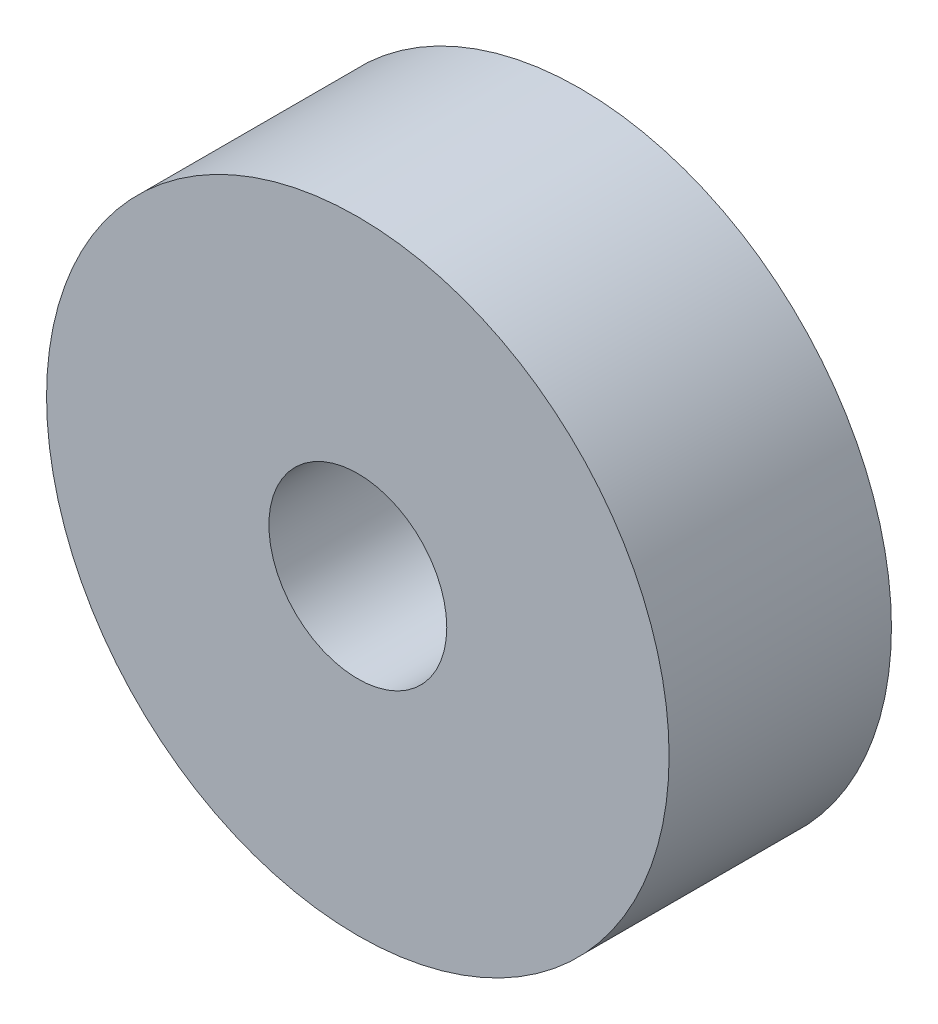
from build123d import *

# Parameters (mm, degrees)
SKETCH1_R           = 14
SKETCH1_R_2         = 4
BOSS_EXTRUDE1_DEPTH = 10


with BuildPart() as part:
    # Sketch1 → Boss-Extrude1 (new body)
    with BuildSketch(Plane.XY):
        Circle(SKETCH1_R)
        Circle(SKETCH1_R_2, mode=Mode.SUBTRACT)
    extrude(amount=BOSS_EXTRUDE1_DEPTH)


solid = part.part
